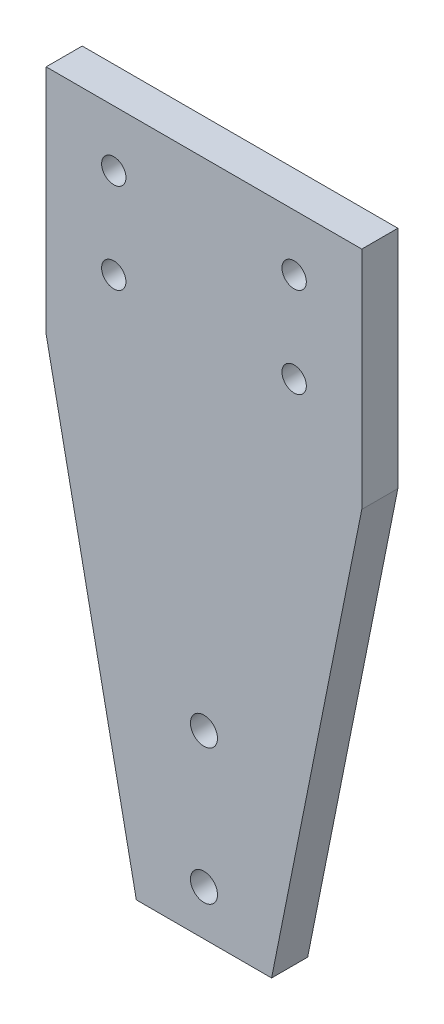
from build123d import *

# Parameters (mm, degrees)
SKETCH1_R           = 3.81
SKETCH1_R_2         = 3.429
BOSS_EXTRUDE1_DEPTH = 10.16


with BuildPart() as part:
    # Sketch1 → Boss-Extrude1 (new body)
    with BuildSketch(Plane.XY):
        Polygon((0, 0), (38.1, 0), (63.5, 127), (63.5, 190.5), (-25.4, 190.5), (-25.4, 125.291623319), align=None)
        with Locations((19.05, 12.7)):
            Circle(SKETCH1_R, mode=Mode.SUBTRACT)
        with Locations((19.05, 50.8)):
            Circle(SKETCH1_R, mode=Mode.SUBTRACT)
        with Locations((-6.35, 174.687730396)):
            Circle(SKETCH1_R_2, mode=Mode.SUBTRACT)
        with Locations((-6.35, 149.287730396)):
            Circle(SKETCH1_R_2, mode=Mode.SUBTRACT)
        with Locations(Location((44.45, 149.287730396, 0), (0, 0, 180))):
            Circle(SKETCH1_R_2, mode=Mode.SUBTRACT)
        with Locations(Location((44.45, 174.687730396, 0), (0, 0, 180))):
            Circle(SKETCH1_R_2, mode=Mode.SUBTRACT)
    extrude(amount=BOSS_EXTRUDE1_DEPTH)


solid = part.part
